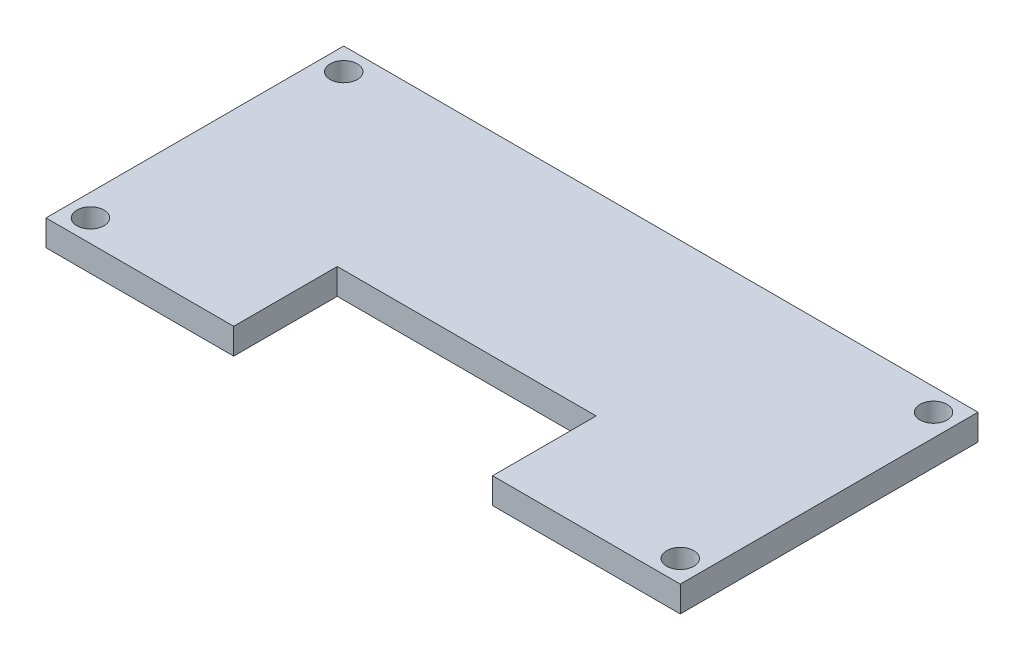
from build123d import *

# Parameters (mm, degrees)
SKETCH_1_R      = 1.05
EXTRUDE_1_DEPTH = 2


with BuildPart() as part:
    # 草图1 → 凸台-拉伸1 (new body)
    with BuildSketch(Plane(origin=(0, 0, 0), x_dir=(1, 0, 0), z_dir=(0, 1, 0))):
        Polygon((-24.5, -11.5), (-10, -11.5), (-10, -3.5), (10, -3.5), (10, -11.5), (24.5, -11.5), (24.5, 11.5), (-24.5, 11.5), align=None)
        with Locations(Location((-22.782842712, 9.782842712, 0), (0, 0, 270))):
            Circle(SKETCH_1_R, mode=Mode.SUBTRACT)
        with Locations(Location((22.782842712, 9.782842712, 0), (0, 0, 90))):
            Circle(SKETCH_1_R, mode=Mode.SUBTRACT)
        with Locations(Location((22.782842712, -9.782842712, 0), (0, 0, 270))):
            Circle(SKETCH_1_R, mode=Mode.SUBTRACT)
        with Locations(Location((-22.782842712, -9.782842712, 0), (0, 0, 90))):
            Circle(SKETCH_1_R, mode=Mode.SUBTRACT)
    extrude(amount=EXTRUDE_1_DEPTH)


solid = part.part
